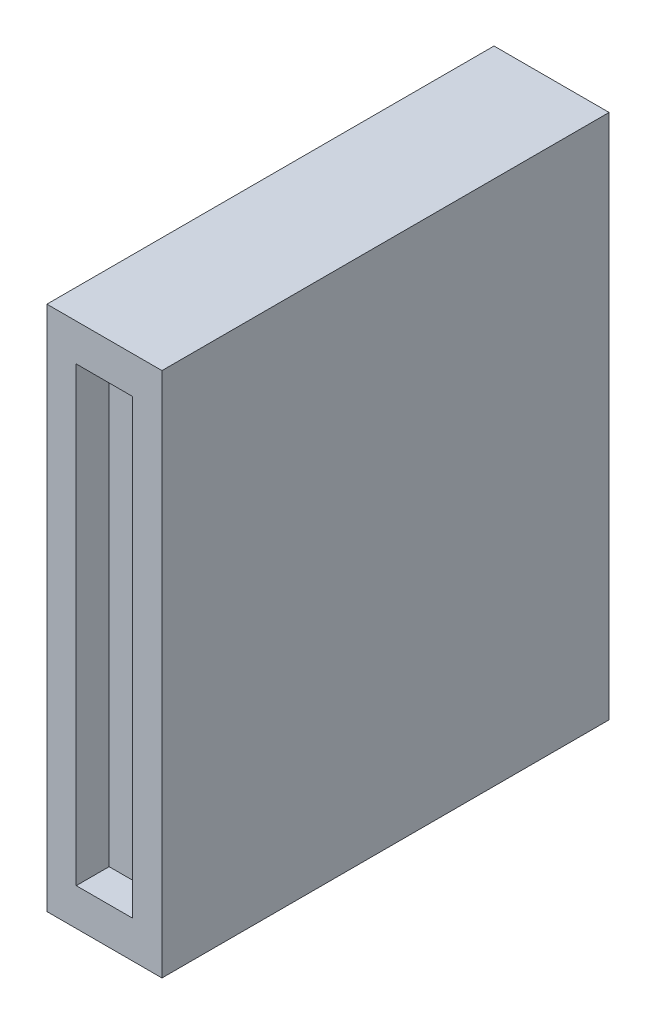
from build123d import *

# Parameters (mm, degrees)
SKETCH1_W           = 17.5
SKETCH1_H           = 80
BOSS_EXTRUDE1_DEPTH = 68
SKETCH2_W           = 8.576267668
SKETCH2_H           = 68.714399462
CUT_EXTRUDE1_DEPTH  = 5


with BuildPart() as part:
    # Sketch1 → Boss-Extrude1 (new body)
    with BuildSketch(Plane.XY):
        Rectangle(SKETCH1_W, SKETCH1_H)
    extrude(amount=BOSS_EXTRUDE1_DEPTH)

    # Sketch2 → Cut-Extrude1 (cut)
    with BuildSketch(Plane.XY.offset(68)):
        Rectangle(SKETCH2_W, SKETCH2_H)
    extrude(amount=-CUT_EXTRUDE1_DEPTH, mode=Mode.SUBTRACT)


solid = part.part
